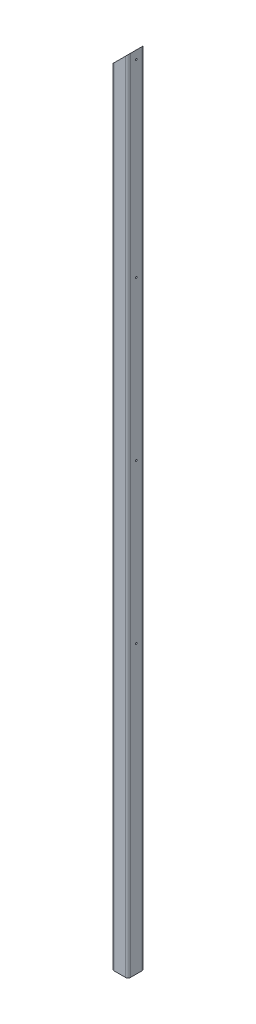
from build123d import *

# Parameters (mm, degrees)
TUBE_SQUARE_40_X_40_X_3_2_1_DEPTH = 1920
CUT_EXTRUDE1_DEPTH                = 1921.52076271
SKETCH16_R                        = 2
CUT_EXTRUDE2_DEPTH                = 3
SKETCH17_R                        = 2
CUT_EXTRUDE3_DEPTH                = 3


with BuildPart() as part:
    # Sketch15 → Tube (square) 40 X 40 X 3.2(1) (new body)
    with BuildSketch(Plane(origin=(0, 0, 0), x_dir=(-1, 0, 0), z_dir=(0, 1, 0))):
        with BuildLine():
            Line((-13.6, -20), (13.6, -20))
            ThreePointArc((13.6, -20), (18.1254834, -18.1254834), (20, -13.6))
            Line((20, -13.6), (20, 13.6))
            ThreePointArc((20, 13.6), (18.1254834, 18.1254834), (13.6, 20))
            Line((13.6, 20), (-13.6, 20))
            ThreePointArc((-13.6, 20), (-18.1254834, 18.1254834), (-20, 13.6))
            Line((-20, 13.6), (-20, -13.6))
            ThreePointArc((-20, -13.6), (-18.1254834, -18.1254834), (-13.6, -20))
        make_face()
        with BuildLine():
            Line((-13.6, -16.8), (13.6, -16.8))
            ThreePointArc((13.6, -16.8), (15.8627417, -15.8627417), (16.8, -13.6))
            Line((16.8, -13.6), (16.8, 13.6))
            ThreePointArc((16.8, 13.6), (15.8627417, 15.8627417), (13.6, 16.8))
            Line((13.6, 16.8), (-13.6, 16.8))
            ThreePointArc((-13.6, 16.8), (-15.8627417, 15.8627417), (-16.8, 13.6))
            Line((-16.8, 13.6), (-16.8, -13.6))
            ThreePointArc((-16.8, -13.6), (-15.8627417, -15.8627417), (-13.6, -16.8))
        make_face(mode=Mode.SUBTRACT)
    extrude(amount=TUBE_SQUARE_40_X_40_X_3_2_1_DEPTH)

    # Sketch13 → Cut-Extrude1 (cut, through all)
    with BuildSketch(Plane(origin=(0, 0, -20), x_dir=(-1, 0, 0), z_dir=(0, 0, -1))):
        Polygon((20, 1880), (-20, 1920), (20, 1920), align=None)
    extrude(amount=-CUT_EXTRUDE1_DEPTH, mode=Mode.SUBTRACT)

    # Sketch16 → Cut-Extrude2 (cut)
    with BuildSketch(Plane(origin=(20, 0, 0), x_dir=(0, 0, -1), z_dir=(1, 0, 0))):
        with Locations((0, 1900)):
            Circle(SKETCH16_R)
        with Locations((0, 1447)):
            Circle(SKETCH16_R)
        with Locations((0, 1067)):
            Circle(SKETCH16_R)
        with Locations((0, 687)):
            Circle(SKETCH16_R)
    extrude(amount=-CUT_EXTRUDE2_DEPTH, mode=Mode.SUBTRACT)

    # Sketch17 → Cut-Extrude3 (cut)
    with BuildSketch(Plane(origin=(0, 0, -20), x_dir=(-1, 0, 0), z_dir=(0, 0, -1))):
        with Locations((0, 687)):
            Circle(SKETCH17_R)
        with Locations((0, 937)):
            Circle(SKETCH17_R)
    extrude(amount=-CUT_EXTRUDE3_DEPTH, mode=Mode.SUBTRACT)


solid = part.part
